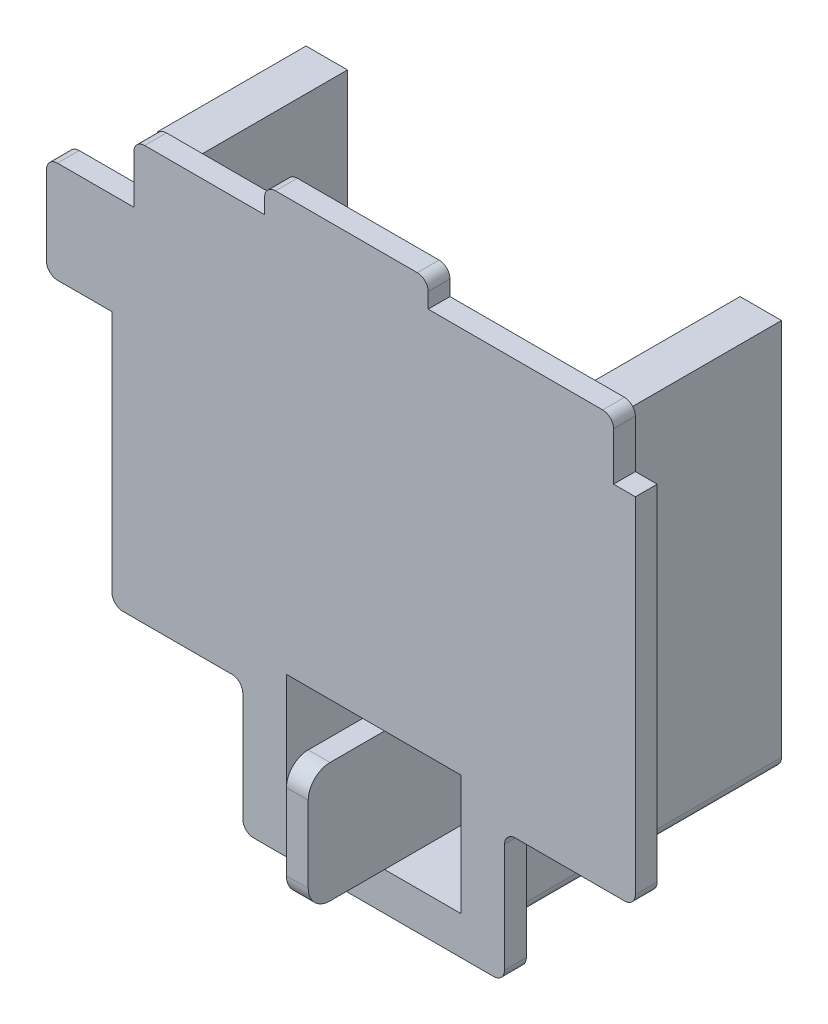
from build123d import *

# Parameters (mm, degrees)
BOSS_EXTRUDE1_DEPTH = 2
FILLET1_R           = 1
BOSS_EXTRUDE2_DEPTH = 13.6
SKETCH4_W           = 7
SKETCH4_H           = 11
CUT_EXTRUDE1_DEPTH  = 11.2
SKETCH5_W           = 2
SKETCH5_H           = 11
BOSS_EXTRUDE3_DEPTH = 7
FILLET2_R           = 2
FILLET3_R           = 1


with BuildPart() as part:
    # Sketch1 → Boss-Extrude1 (new body)
    with BuildSketch(Plane.XY):
        Polygon((0, 0), (12, 0), (12, 12), (24, 12), (24, 44.6), (22, 44.6), (22, 50), (5, 50), (5, 52.4), (-10, 52.4), (-10, 50), (-22, 50), (-22, 44.6), (-30, 44.6), (-30, 35.3), (-24, 35.3), (-24, 12), (-12, 12), (-12, 0), align=None)
    extrude(amount=BOSS_EXTRUDE1_DEPTH)

    # Fillet1
    fillet1_edges = [part.edges().sort_by_distance(p)[0] for p in [
        (-12, 0, 1),
        (-12, 12, 1),
        (-24, 12, 1),
        (-30, 35.3, 1),
        (-30, 44.6, 1),
        (-22, 50, 1),
        (-10, 52.4, 1),
        (5, 52.4, 1),
        (22, 50, 1),
        (24, 12, 1),
        (12, 12, 1),
        (12, 0, 1),
    ]]
    fillet(fillet1_edges, radius=FILLET1_R)

    # Sketch3 → Boss-Extrude2 (add)
    with BuildSketch(Plane(origin=(0, 0, 0), x_dir=(-1, 0, 0), z_dir=(0, 0, -1))):
        Polygon((-21.8, 49.7), (-21.8, 14), (-9.8, 14), (-9.8, 2.2), (9.8, 2.2), (9.8, 14), (21.8, 14), (21.8, 49.7), (18, 49.7), (18, 21.8), (-18, 21.8), (-18, 49.7), align=None)
    extrude(amount=BOSS_EXTRUDE2_DEPTH)

    # Sketch4 → Cut-Extrude1 (cut)
    with BuildSketch(Plane.XY.offset(2)):
        with Locations((4.5, 9)):
            Rectangle(SKETCH4_W, SKETCH4_H)
        with Locations((-4.5, 9)):
            Rectangle(SKETCH4_W, SKETCH4_H)
    extrude(amount=-CUT_EXTRUDE1_DEPTH, mode=Mode.SUBTRACT)

    # Sketch5 → Boss-Extrude3 (add)
    with BuildSketch(Plane.XY.offset(2)):
        with Locations((0, 9)):
            Rectangle(SKETCH5_W, SKETCH5_H)
    extrude(amount=BOSS_EXTRUDE3_DEPTH)

    # Fillet2
    fillet2_edges = [part.edges().sort_by_distance(p)[0] for p in [
        (0, 14.5, 9),
        (0, 3.5, 9),
    ]]
    fillet(fillet2_edges, radius=FILLET2_R)

    # Fillet3
    fillet3_edges = [part.edges().sort_by_distance(p)[0] for p in [
        (21.8, 14, -6.8),
        (9.8, 14, -6.8),
        (9.8, 2.2, -6.8),
        (-9.8, 2.2, -6.8),
        (-9.8, 14, -6.8),
        (-21.8, 14, -6.8),
    ]]
    fillet(fillet3_edges, radius=FILLET3_R)


solid = part.part
